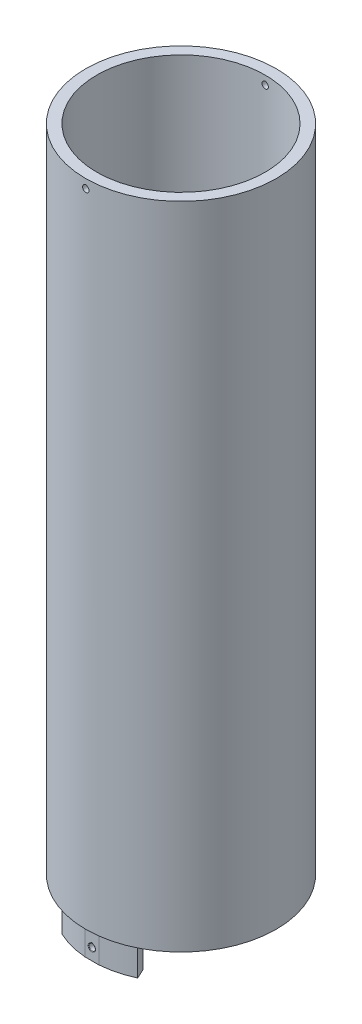
from build123d import *

# Parameters (mm, degrees)
CUT_EXTRUDE1_DEPTH      = 269.763771223
CUT_EXTRUDE1_DEPTH_BACK = 269.763771223
CUT_EXTRUDE4_DEPTH      = 13.97
CUT_EXTRUDE5_DEPTH      = 13.97
CIRPATTERN1_COUNT       = 2
CUT_EXTRUDE6_DEPTH      = 269.763771223
CUT_EXTRUDE6_DEPTH_BACK = 269.763771223
FILLET1_R               = 0.254


with BuildPart() as part:
    # Sketch1 → Revolve1 (revolve)
    with BuildSketch(Plane.XY, mode=Mode.PRIVATE) as revolve1_sk:
        with BuildLine():
            Line((-38.8239, 261.4935178), (-43.9039, 261.4935178))
            Line((-43.9039, 261.4935178), (-43.9039, -38.2264822))
            Line((-43.9039, -38.2264822), (-41.2369, -38.2264822))
            Line((-41.2369, -38.2264822), (-41.2369, -52.1964822))
            Line((-41.2369, -52.1964822), (-36.1569, -52.1964822))
            Line((-36.1569, -52.1964822), (-36.1569, -38.2264822))
            ThreePointArc((-36.1569, -38.2264822), (-36.832638636, -32.406611067), (-38.8239, -26.89640228))
            Line((-38.8239, -26.89640228), (-38.8239, 261.4935178))
        make_face()
    revolve(revolve1_sk.sketch.rotate(Axis((0, 16.071963393, 0), (0, -1, 0)), 270), axis=Axis((0, 16.071963393, 0), (0, -1, 0)))

    # Sketch2 → Cut-Extrude1 (cut, two sides: drawn at the far end of the back side and taken through both)
    with BuildSketch(Plane.XY.offset(-CUT_EXTRUDE1_DEPTH_BACK)):
        with BuildLine():
            Line((-0.771031735, -45.62095313), (0, -45.150169247))
            Line((0, -45.150169247), (0.771031735, -45.62095313))
            ThreePointArc((0.771031735, -45.62095313), (0, -48.363269247), (-0.771031735, -45.62095313))
        make_face()
    extrude(amount=CUT_EXTRUDE1_DEPTH + CUT_EXTRUDE1_DEPTH_BACK, mode=Mode.SUBTRACT)

    # Sketch3 → Cut-Extrude4 (cut)
    with BuildSketch(Plane.XZ.offset(52.1964822)):
        with BuildLine():
            Line((-17.427466998, -37.373323583), (0, 0))
            Line((0, 0), (-17.427466998, 37.373323583))
            ThreePointArc((-17.427466998, 37.373323583), (-41.2369, 0), (-17.427466998, -37.373323583))
        make_face()
        with BuildLine():
            Line((17.427466998, 37.373323583), (0, 0))
            Line((0, 0), (17.427466998, -37.373323583))
            ThreePointArc((17.427466998, -37.373323583), (34.778848712, -22.156570219), (41.2369, 0))
            ThreePointArc((41.2369, 0), (34.778848712, 22.156570219), (17.427466998, 37.373323583))
        make_face()
    extrude(amount=-CUT_EXTRUDE4_DEPTH, mode=Mode.SUBTRACT)

    # Sketch4 → Cut-Extrude5 (cut)
    with BuildSketch(Plane.XZ.offset(52.1964822)):
        with BuildLine():
            ThreePointArc((-3.2004, -41.112520738), (-1.601408002, -41.205793452), (0, -41.2369))
            ThreePointArc((0, -41.2369), (1.601408002, -41.205793452), (3.2004, -41.112520738))
            Line((3.2004, -41.112520738), (-3.2004, -41.112520738))
        make_face()
    cut_extrude5 = extrude(amount=-CUT_EXTRUDE5_DEPTH, mode=Mode.SUBTRACT)

    # CirPattern1: Cut-Extrude5 ×2 about axis
    cirpattern1_axis = Axis((0, 0, 0), (0, 1, 0))
    for i in range(1, CIRPATTERN1_COUNT):
        add(cut_extrude5.rotate(cirpattern1_axis, i * 360 / CIRPATTERN1_COUNT), mode=Mode.SUBTRACT)

    # Sketch5 → Cut-Extrude6 (cut, two sides: drawn at the far end of the back side and taken through both)
    with BuildSketch(Plane.XY.offset(-CUT_EXTRUDE6_DEPTH_BACK)):
        with BuildLine():
            Line((-0.771031735, 258.692283917), (0, 259.1630678))
            Line((0, 259.1630678), (0.771031735, 258.692283917))
            ThreePointArc((0.771031735, 258.692283917), (0, 255.9499678), (-0.771031735, 258.692283917))
        make_face()
    extrude(amount=CUT_EXTRUDE6_DEPTH + CUT_EXTRUDE6_DEPTH_BACK, mode=Mode.SUBTRACT)

    # Fillet1
    fillet1_edges = [part.edges().sort_by_distance(p)[0] for p in [
        (-0.385515867, -45.385561188, 41.112520738),
        (0.385515867, -45.385561188, 41.112520738),
        (0, -48.363269247, 41.112520738),
        (0, -48.363269247, -41.112520738),
        (-0.385515867, -45.385561188, -41.112520738),
        (0.385515867, -45.385561188, -41.112520738),
    ]]
    fillet(fillet1_edges, radius=FILLET1_R)


solid = part.part
